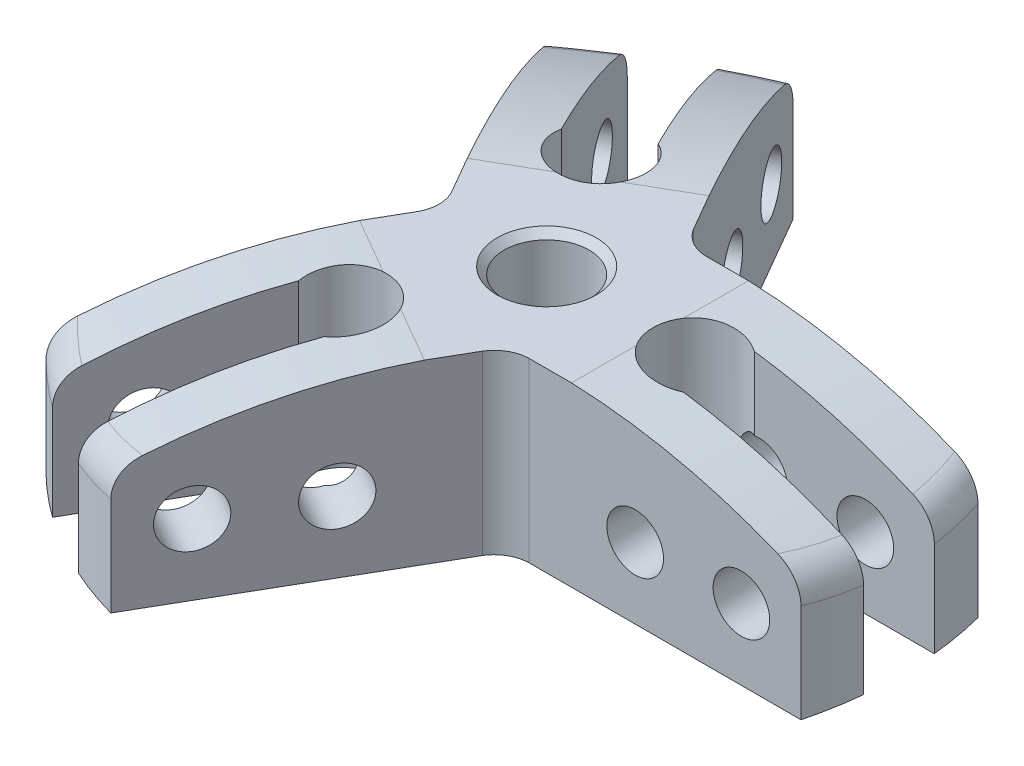
from build123d import *

# Parameters (mm, degrees)
SKETCH1_R                 = 16
SKETCH1_R_2               = 6
BOSS_EXTRUDE1_DEPTH       = 25
SKETCH2_R                 = 4
BOSS_EXTRUDE2_DEPTH       = 12.5
SKETCH4_R                 = 6
CUT_EXTRUDE2_DEPTH        = 59.14636704
FILLET1_R                 = 5
CIRPATTERN14_COUNT        = 3
FILLET1_OF_CIRPATTERN14_R = 5
CUT_EXTRUDE3_DEPTH        = 74.627124635
CIRPATTERN18_COUNT        = 3
CHAMFER1_SIZE             = 1


with BuildPart() as part:
    # Sketch1 → Boss-Extrude1 (new body)
    with BuildSketch(Plane(origin=(0, 0, 0), x_dir=(1, 0, 0), z_dir=(0, 1, 0))):
        with Locations(Location((0, 0, 0), (0, 0, 270))):
            Circle(SKETCH1_R)
        with Locations(Location((0, 0, 0), (0, 0, 270))):
            Circle(SKETCH1_R_2, mode=Mode.SUBTRACT)
    extrude(amount=BOSS_EXTRUDE1_DEPTH)

    # Sketch2 → Boss-Extrude2 (add, symmetric)
    with BuildSketch(Plane.XY):
        with BuildLine():
            Line((0, 0), (50, 0))
            Line((50, 0), (50, 16.487830394))
            ThreePointArc((50, 16.487830394), (33.443508402, 22.515412518), (16, 25))
            Line((16, 25), (0, 25))
            Line((0, 25), (0, 0))
        make_face()
        with Locations((40, 10)):
            Circle(SKETCH2_R, mode=Mode.SUBTRACT)
        with Locations((25, 10)):
            Circle(SKETCH2_R, mode=Mode.SUBTRACT)
    boss_extrude2 = extrude(amount=BOSS_EXTRUDE2_DEPTH, both=True)

    # Sketch4 → Cut-Extrude2 (cut, through all)
    with BuildSketch(Plane(origin=(0, 25, 0), x_dir=(1, 0, 0), z_dir=(0, 1, 0))):
        with Locations(Location((0, 0, 0), (0, 0, 270))):
            Circle(SKETCH4_R)
        with BuildLine():
            Line((47.266299667, 16.306345874), (75.230688158, 16.306345874))
            Line((75.230688158, 16.306345874), (75.230688158, -14.453169325))
            Line((75.230688158, -14.453169325), (47.865497976, -14.453169325))
            ThreePointArc((47.865497976, -14.453169325), (49.035765576, -9.772087515), (49.749371855, -5))
            Line((49.749371855, -5), (24.31662479, -5))
            ThreePointArc((24.31662479, -5), (15, 0), (24.31662479, 5))
            Line((24.31662479, 5), (49.749371855, 5))
            ThreePointArc((49.749371855, 5), (48.836139226, 10.725274146), (47.266299667, 16.306345874))
        make_face()
    cut_extrude2 = extrude(amount=-CUT_EXTRUDE2_DEPTH, mode=Mode.SUBTRACT)

    # Fillet1
    fillet1_edges = [part.edges().sort_by_distance(p)[0] for p in [
        (49.22295948, 16.861179359, -8.780675316),
        (49.22295948, 16.861179359, 8.780675316),
    ]]
    fillet(fillet1_edges, radius=FILLET1_R)

    # CirPattern14: Boss-Extrude2, Cut-Extrude2 ×3 about axis
    cirpattern14_axis = Axis((0, 0, 0), (0, 1, 0))
    add([boss_extrude2.rotate(cirpattern14_axis, i * 360 / CIRPATTERN14_COUNT) for i in range(1, CIRPATTERN14_COUNT)])
    add([cut_extrude2.rotate(cirpattern14_axis, i * 360 / CIRPATTERN14_COUNT) for i in range(1, CIRPATTERN14_COUNT)], mode=Mode.SUBTRACT)

    # Fillet1 of CirPattern14
    fillet1_of_cirpattern14_edges = [part.edges().sort_by_distance(p)[0] for p in [
        (-32.215767626, 16.861179359, -38.237995701),
        (-17.007191854, 16.861179359, -47.018671017),
        (-17.007191854, 16.861179359, 47.018671017),
        (-32.215767626, 16.861179359, 38.237995701),
    ]]
    fillet(fillet1_of_cirpattern14_edges, radius=FILLET1_OF_CIRPATTERN14_R)

    # Sketch5 → Cut-Extrude3 (cut, symmetric)
    with BuildSketch(Plane(origin=(0, 25, 0), x_dir=(1, 0, 0), z_dir=(0, 1, 0))):
        with BuildLine():
            ThreePointArc((9.987492178, 12.5), (8, 13.856406461), (5.831571458, 14.899421946))
            ThreePointArc((5.831571458, 14.899421946), (7.602861155, 13.168541804), (9.987492178, 12.5))
        make_face()
    cut_extrude3 = extrude(amount=CUT_EXTRUDE3_DEPTH, both=True, mode=Mode.SUBTRACT)

    # CirPattern18: Cut-Extrude3 ×3 about axis
    cirpattern18_axis = Axis((0, 0, 0), (0, 1, 0))
    for i in range(1, CIRPATTERN18_COUNT):
        add(cut_extrude3.rotate(cirpattern18_axis, i * 360 / CIRPATTERN18_COUNT), mode=Mode.SUBTRACT)

    # Chamfer1
    chamfer1_edges = [part.edges().sort_by_distance(p)[0] for p in [
        (-5.196152423, 25, 3),
    ]]
    chamfer(chamfer1_edges, length=CHAMFER1_SIZE)


solid = part.part
